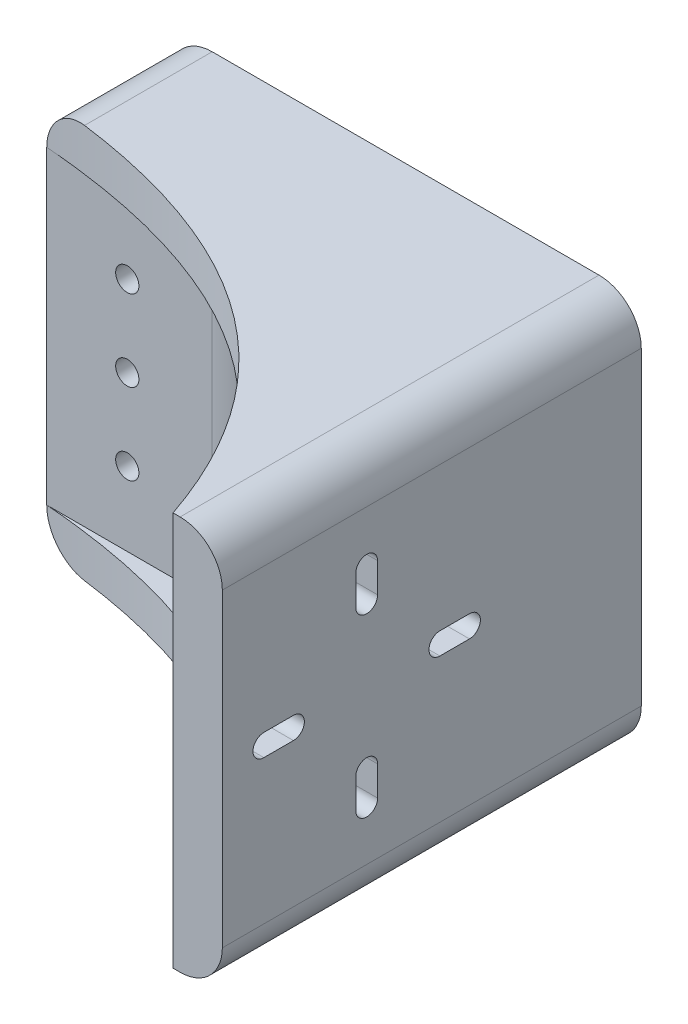
from build123d import *

# Parameters (mm, degrees)
ESBO_O1_W                = 66.94
ESBO_O1_H                = 40
RESSALTO_EXTRUS_O1_DEPTH = 9.5
ESBO_O2_W                = 7
ESBO_O2_H                = 40
RESSALTO_EXTRUS_O2_DEPTH = 50
ESBO_O3_W                = 28.44
ESBO_O3_H                = 40
RESSALTO_EXTRUS_O3_DEPTH = 8
RESSALTO_EXTRUS_O4_DEPTH = 2
RESSALTO_EXTRUS_O5_DEPTH = 6
FILETE1_R                = 5
FILETE2_R                = 20
ESBO_O6_R                = 1.65
CORTE_EXTRUS_O1_DEPTH    = 63.217786628
CORTE_EXTRUS_O2_DEPTH    = 8
FILETE4_R                = 6
CORTE_EXTRUS_O3_DEPTH    = 94.912194911


with BuildPart() as part:
    # Esboço1 → Ressalto-extrusão1 (new body)
    with BuildSketch(Plane.XY):
        with Locations((2.706874237, 0.253968254)):
            Rectangle(ESBO_O1_W, ESBO_O1_H)
    extrude(amount=RESSALTO_EXTRUS_O1_DEPTH)

    # Esboço2 → Ressalto-extrusão2 (add)
    with BuildSketch(Plane.XY.offset(9.5)):
        with Locations((32.676874237, 0.253968254)):
            Rectangle(ESBO_O2_W, ESBO_O2_H)
    extrude(amount=RESSALTO_EXTRUS_O2_DEPTH)

    # Esboço3 → Ressalto-extrusão3 (add)
    with BuildSketch(Plane.XY.offset(9.5)):
        with Locations((-16.543125763, 0.253968254)):
            Rectangle(ESBO_O3_W, ESBO_O3_H)
    extrude(amount=RESSALTO_EXTRUS_O3_DEPTH)

    # Esboço4 → Ressalto-extrusão4 (add)
    with BuildSketch(Plane.XZ.offset(19.746031746)):
        Polygon((-2.323125763, 9.5), (-2.323125763, 17.5), (-30.763125763, 17.5), (-30.763125763, 0), (36.176874237, 0), (36.176874237, 59.5), (29.176874237, 59.5), (29.176874237, 9.5), align=None)
    ressalto_extrus_o4 = extrude(amount=RESSALTO_EXTRUS_O4_DEPTH)

    # Espelhar1: Ressalto-extrusão4 across plane
    add(ressalto_extrus_o4.mirror(Plane.ZX.offset(0.253968254)))

    # Esboço5 → Ressalto-extrusão5 (add)
    with BuildSketch(Plane.XZ.offset(21.746031746)):
        with BuildLine():
            Line((36.176874237, 59.5), (29.176874237, 59.5))
            add(Edge.make_bspline(
                [(29.176874237, 59.5), (16.163128622, 21.143295095), (-30.763125763, 17.5)],
                knots=[0, 0, 0, 1, 1, 1], degree=2))
            Line((-30.763125763, 17.5), (-30.763125763, 0))
            Line((-30.763125763, 0), (36.176874237, 0))
            Line((36.176874237, 0), (36.176874237, 59.5))
        make_face()
    ressalto_extrus_o5 = extrude(amount=RESSALTO_EXTRUS_O5_DEPTH)

    # Espelhar2: Ressalto-extrusão5 across plane
    add(ressalto_extrus_o5.mirror(Plane.ZX.offset(0.253968254)))

    # Filete1
    filete1_edges = [part.edges().sort_by_distance(p)[0] for p in [
        (-2.323125763, 0.253968254, 17.5),
    ]]
    fillet(filete1_edges, radius=FILETE1_R)

    # Filete2
    filete2_edges = [part.edges().sort_by_distance(p)[0] for p in [
        (29.176874237, 0.253968254, 9.5),
    ]]
    fillet(filete2_edges, radius=FILETE2_R)

    # Esboço6 → Corte-extrusão1 (cut, through all)
    with BuildSketch(Plane.XY.offset(17.5)):
        with Locations((-19.323125763, 11.753968254)):
            Circle(ESBO_O6_R)
        with Locations((-19.323125763, 0.253968254)):
            Circle(ESBO_O6_R)
        with Locations((-19.323125763, -11.246031746)):
            Circle(ESBO_O6_R)
    extrude(amount=-CORTE_EXTRUS_O1_DEPTH, mode=Mode.SUBTRACT)

    # Esboço7 → Corte-extrusão2 (cut)
    with BuildSketch(Plane(origin=(0, 0, 0), x_dir=(-1, 0, 0), z_dir=(0, 0, -1))):
        with BuildLine():
            Line((27.323125763, 11.753968254), (27.323125763, -11.246031746))
            ThreePointArc((27.323125763, -11.246031746), (19.323125763, -19.246031746), (11.323125763, -11.246031746))
            Line((11.323125763, -11.246031746), (11.323125763, 11.753968254))
            ThreePointArc((11.323125763, 11.753968254), (19.323125763, 19.753968254), (27.323125763, 11.753968254))
        make_face()
    extrude(amount=-CORTE_EXTRUS_O2_DEPTH, mode=Mode.SUBTRACT)

    # Filete4
    filete4_edges = [part.edges().sort_by_distance(p)[0] for p in [
        (36.176874237, 28.253968254, 29.75),
        (-30.763125763, 28.253968254, 8.75),
        (-30.763125763, -27.746031746, 8.75),
        (36.176874237, -27.746031746, 29.75),
    ]]
    fillet(filete4_edges, radius=FILETE4_R)

    # Esboço8 → Corte-extrusão3 (cut, through all)
    with BuildSketch(Plane(origin=(36.176874237, 0, 0), x_dir=(0, 0, -1), z_dir=(1, 0, 0))):
        with BuildLine():
            Line((-53.6, 1.803968254), (-49.4, 1.803968254))
            ThreePointArc((-49.4, 1.803968254), (-47.85, 0.253968254), (-49.4, -1.296031746))
            Line((-49.4, -1.296031746), (-53.6, -1.296031746))
            ThreePointArc((-53.6, -1.296031746), (-55.15, 0.253968254), (-53.6, 1.803968254))
        make_face()
        with BuildLine():
            Line((-40.55, -14.346031746), (-40.55, -10.146031746))
            ThreePointArc((-40.55, -10.146031746), (-39, -8.596031746), (-37.45, -10.146031746))
            Line((-37.45, -10.146031746), (-37.45, -14.346031746))
            ThreePointArc((-37.45, -14.346031746), (-39, -15.896031746), (-40.55, -14.346031746))
        make_face()
        with BuildLine():
            Line((-24.4, -1.296031746), (-28.6, -1.296031746))
            ThreePointArc((-28.6, -1.296031746), (-30.15, 0.253968254), (-28.6, 1.803968254))
            Line((-28.6, 1.803968254), (-24.4, 1.803968254))
            ThreePointArc((-24.4, 1.803968254), (-22.85, 0.253968254), (-24.4, -1.296031746))
        make_face()
        with BuildLine():
            Line((-37.45, 14.853968254), (-37.45, 10.653968254))
            ThreePointArc((-37.45, 10.653968254), (-39, 9.103968254), (-40.55, 10.653968254))
            Line((-40.55, 10.653968254), (-40.55, 14.853968254))
            ThreePointArc((-40.55, 14.853968254), (-39, 16.403968254), (-37.45, 14.853968254))
        make_face()
    extrude(amount=-CORTE_EXTRUS_O3_DEPTH, mode=Mode.SUBTRACT)


solid = part.part
